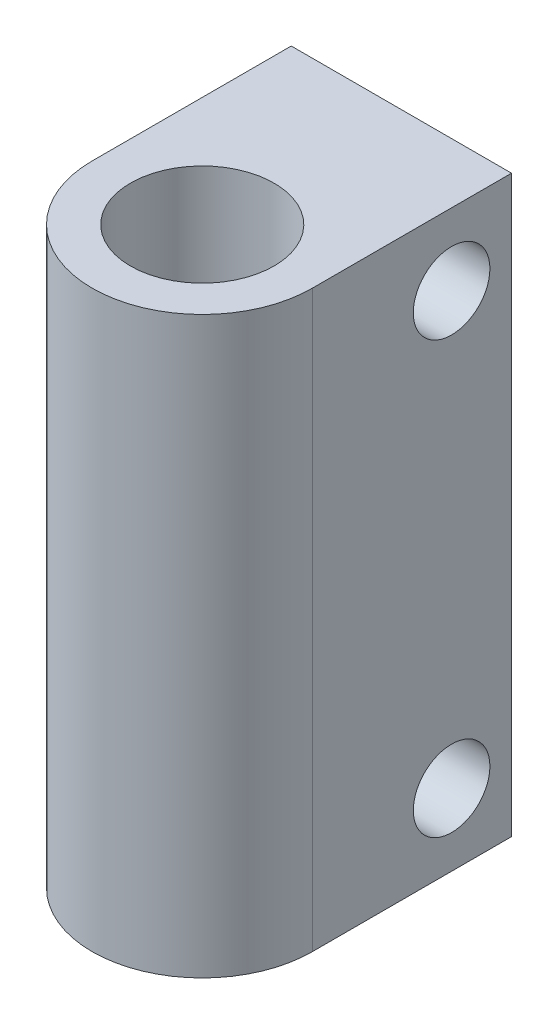
from build123d import *

# Parameters (mm, degrees)
SKETCH1_R           = 7.5
BOSS_EXTRUDE1_DEPTH = 60
SKETCH2_R           = 4
CUT_EXTRUDE1_DEPTH  = 50


with BuildPart() as part:
    # Sketch1 → Boss-Extrude1 (new body)
    with BuildSketch(Plane(origin=(0, 0, 0), x_dir=(1, 0, 0), z_dir=(0, 1, 0))):
        with BuildLine():
            Line((-11.5, 0), (-11.5, 20.793359223))
            Line((-11.5, 20.793359223), (11.5, 20.793359223))
            Line((11.5, 20.793359223), (11.5, 0))
            ThreePointArc((11.5, 0), (0, -11.5), (-11.5, 0))
        make_face()
        with Locations(Location((0, 0, 0), (0, 0, 270))):
            Circle(SKETCH1_R, mode=Mode.SUBTRACT)
    extrude(amount=BOSS_EXTRUDE1_DEPTH)

    # Sketch2 → Cut-Extrude1 (cut)
    with BuildSketch(Plane(origin=(11.5, 0, 0), x_dir=(0, 0, -1), z_dir=(1, 0, 0))):
        with Locations((14.537325079, 52.5)):
            Circle(SKETCH2_R)
        with Locations((14.537325079, 7.5)):
            Circle(SKETCH2_R)
    extrude(amount=-CUT_EXTRUDE1_DEPTH, mode=Mode.SUBTRACT)


solid = part.part
